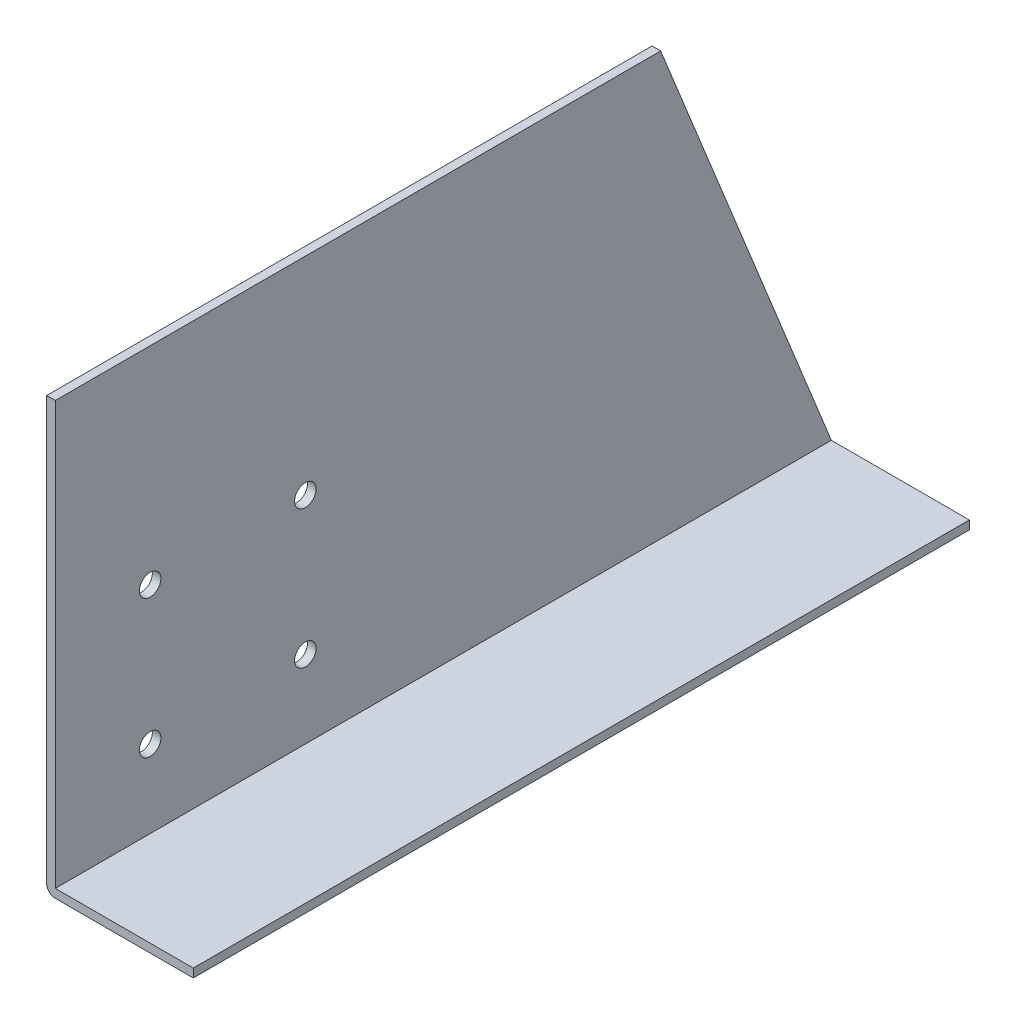
from build123d import *

# Parameters (mm, degrees)
BOSS_EXTRUDE1_DEPTH = 180
FILLET1_R           = 2
SKETCH2_R           = 2.5
CUT_EXTRUDE1_DEPTH  = 180


with BuildPart() as part:
    # Sketch1 → Boss-Extrude1 (new body)
    with BuildSketch(Plane.XY):
        Polygon((-15, 50), (-15, -48), (17, -48), (17, -50), (-17, -50), (-17, 50), align=None)
    extrude(amount=BOSS_EXTRUDE1_DEPTH)

    # Fillet1
    fillet1_edges = [part.edges().sort_by_distance(p)[0] for p in [
        (-17, -50, 90),
    ]]
    fillet(fillet1_edges, radius=FILLET1_R)

    # Sketch2 → Cut-Extrude1 (cut)
    with BuildSketch(Plane.ZY.offset(17)):
        with Locations(Location((122, 2, 0), (0, 0, 270))):
            Circle(SKETCH2_R)
        with Locations(Location((122, -30, 0), (0, 0, 270))):
            Circle(SKETCH2_R)
        with Locations(Location((158, -30, 0), (0, 0, 270))):
            Circle(SKETCH2_R)
        with Locations(Location((158, 2, 0), (0, 0, 270))):
            Circle(SKETCH2_R)
        Polygon((0, -48), (39.594570132, 50), (0, 50), align=None)
    extrude(amount=-CUT_EXTRUDE1_DEPTH, mode=Mode.SUBTRACT)


solid = part.part
